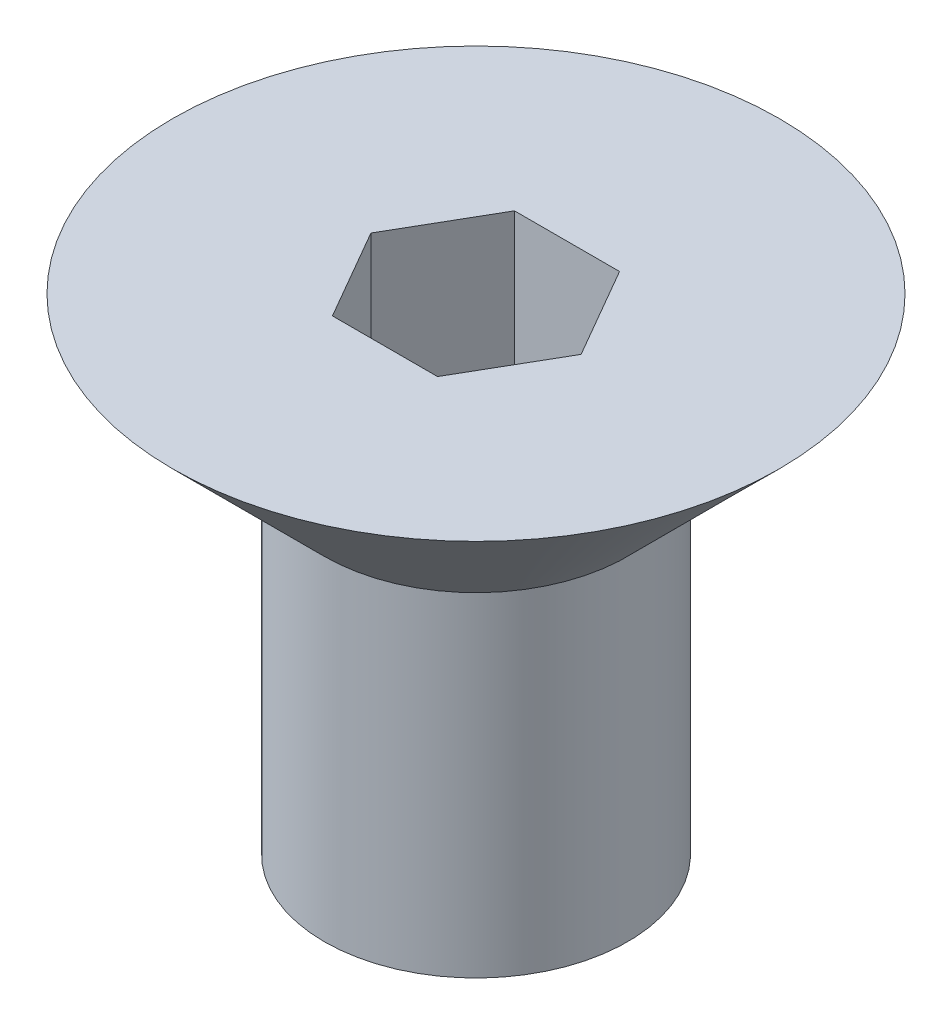
from build123d import *

# Parameters (mm, degrees)
CUT_EXTRUDE1_DEPTH = 5


with BuildPart() as part:
    # Sketch1 → Revolve1 (revolve)
    with BuildSketch(Plane.XY, mode=Mode.PRIVATE) as revolve1_sk:
        Polygon((0, -16), (5, -16), (5, -5), (10, 0), (0, 0), align=None)
    revolve(revolve1_sk.sketch.rotate(Axis((0, 61.691642626, 0), (0, -1, 0)), 90), axis=Axis((0, 61.691642626, 0), (0, -1, 0)))

    # Sketch2 → Cut-Extrude1 (cut)
    with BuildSketch(Plane(origin=(0, 0, 0), x_dir=(-1, 0, 0), z_dir=(0, 1, 0))):
        Polygon((-1.732050808, -3), (1.732050808, -3), (3.464101615, 0), (1.732050808, 3), (-1.732050808, 3), (-3.464101615, 0), align=None)
    extrude(amount=-CUT_EXTRUDE1_DEPTH, mode=Mode.SUBTRACT)


solid = part.part
